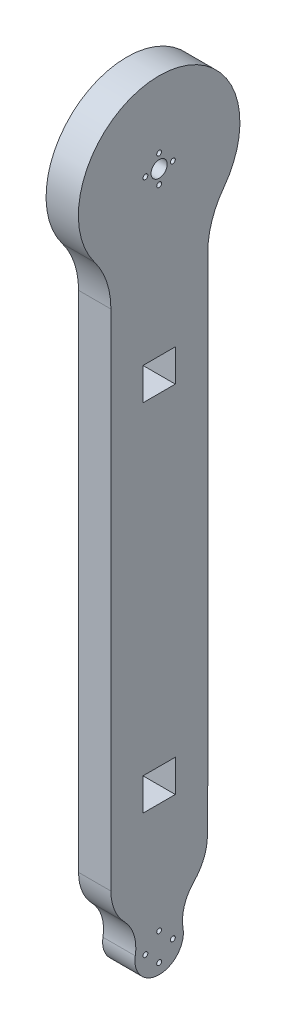
from build123d import *

# Parameters (mm, degrees)
SKETCH1_W           = 10
SKETCH1_H           = 10
BOSS_EXTRUDE1_DEPTH = 10
SKETCH2_R           = 0.75
CUT_EXTRUDE1_DEPTH  = 170.265249142
SKETCH3_R           = 0.75
CUT_EXTRUDE2_DEPTH  = 170.265249142
CUT_EXTRUDE5_START  = -10
CUT_EXTRUDE5_DEPTH  = 10
SKETCH5_R           = 2.5
CUT_EXTRUDE6_DEPTH  = 170.265249142


with BuildPart() as part:
    # Sketch1 → Boss-Extrude1 (new body)
    with BuildSketch(Plane(origin=(0, 0, 0), x_dir=(0, 0, -1), z_dir=(1, 0, 0))):
        with BuildLine():
            Line((0, 109.22405545), (0, -43.10336506))
            ThreePointArc((0, -43.10336506), (0.541577594, -48.278843147), (2.142845875, -53.230087397))
            ThreePointArc((2.142845875, -53.230087397), (-15.125529103, -79.668997921), (-32.212650318, -53.112585274))
            ThreePointArc((-32.212650318, -53.112585274), (-30.559421631, -48.088849966), (-30, -42.82975033))
            Line((-30, -42.82975033), (-30, 109.060958061))
            ThreePointArc((-30, 109.060958061), (-31.291322972, 116.99182394), (-35.031890687, 124.103385075))
            ThreePointArc((-35.031890687, 124.103385075), (-15.112146754, 164.150992221), (4.970722417, 124.184939097))
            ThreePointArc((4.970722417, 124.184939097), (1.275203483, 117.106569656), (0, 109.22405545))
        make_face()
        with Locations((-15.061172266, 83.959086258)):
            Rectangle(SKETCH1_W, SKETCH1_H, mode=Mode.SUBTRACT)
        with Locations((-15.061172266, -26.040913742)):
            Rectangle(SKETCH1_W, SKETCH1_H, mode=Mode.SUBTRACT)
    extrude(amount=BOSS_EXTRUDE1_DEPTH)

    # Sketch2 → Cut-Extrude1 (cut, through all)
    with BuildSketch(Plane(origin=(10, 0, 0), x_dir=(0, 0, -1), z_dir=(1, 0, 0))):
        with Locations((-15.061172266, 143.397777589)):
            Circle(SKETCH2_R)
        with Locations((-19.311172266, 139.147777589)):
            Circle(SKETCH2_R)
        with Locations((-10.811172266, 139.147777589)):
            Circle(SKETCH2_R)
        with Locations((-15.061172266, 134.897777589)):
            Circle(SKETCH2_R)
    extrude(amount=-CUT_EXTRUDE1_DEPTH, mode=Mode.SUBTRACT)

    # Sketch3 → Cut-Extrude2 (cut, through all)
    with BuildSketch(Plane(origin=(10, 0, 0), x_dir=(0, 0, -1), z_dir=(1, 0, 0))):
        with Locations((-19.311172266, -69.352222411)):
            Circle(SKETCH3_R)
        with Locations((-15.061172266, -65.102222411)):
            Circle(SKETCH3_R)
        with Locations((-10.811172266, -69.352222411)):
            Circle(SKETCH3_R)
        with Locations((-15.061172266, -73.602222411)):
            Circle(SKETCH3_R)
    extrude(amount=-CUT_EXTRUDE2_DEPTH, mode=Mode.SUBTRACT)

    # Sketch4 → Cut-Extrude5 (cut)
    with BuildSketch(Plane(origin=(10, 0, 0), x_dir=(0, 0, -1), z_dir=(1, 0, 0)).offset(CUT_EXTRUDE5_START)):
        with BuildLine():
            Line((-30, -42.82975033), (-30, -33.739733883))
            Line((-30, -33.739733883), (-50.712575643, -33.739733883))
            Line((-50.712575643, -33.739733883), (-50.712575643, -86.676053834))
            Line((-50.712575643, -86.676053834), (22.03762198, -86.676053834))
            Line((22.03762198, -86.676053834), (22.03762198, -33.739733883))
            Line((22.03762198, -33.739733883), (0, -33.739733883))
            Line((0, -33.739733883), (0, -43.10336506))
            ThreePointArc((0, -43.10336506), (0.541577594, -48.278843147), (2.142845875, -53.230087397))
            ThreePointArc((2.142845875, -53.230087397), (-15.125529103, -79.668997921), (-32.212650318, -53.112585274))
            ThreePointArc((-32.212650318, -53.112585274), (-30.559421631, -48.088849966), (-30, -42.82975033))
        make_face()
        with BuildLine():
            Line((-30, -46.956071773), (-30, -42.82975033))
            ThreePointArc((-30, -42.82975033), (-30.559421631, -48.088849966), (-32.212650318, -53.112585274))
            ThreePointArc((-32.212650318, -53.112585274), (-15.125529103, -79.668997921), (2.142845875, -53.230087397))
            ThreePointArc((2.142845875, -53.230087397), (0.541577594, -48.278843147), (0, -43.10336506))
            Line((0, -43.10336506), (0, -33.739733883))
            Line((0, -33.739733883), (-0.122344533, -33.739733883))
            Line((-0.122344533, -33.739733883), (-0.122344533, -46.956071773))
            ThreePointArc((-0.122344533, -46.956071773), (-1.211385526, -52.547049066), (-4.319271357, -57.320526105))
            ThreePointArc((-4.319271357, -57.320526105), (-7.279094989, -62.31182931), (-7.666142531, -68.101808395))
            ThreePointArc((-7.666142531, -68.101808395), (-15.061172266, -76.852222411), (-22.456202002, -68.101808395))
            ThreePointArc((-22.456202002, -68.101808395), (-22.843249544, -62.31182931), (-25.803073176, -57.320526105))
            ThreePointArc((-25.803073176, -57.320526105), (-28.910959007, -52.547049066), (-30, -46.956071773))
        make_face()
    extrude(amount=CUT_EXTRUDE5_DEPTH, mode=Mode.SUBTRACT)

    # Sketch5 → Cut-Extrude6 (cut, through all)
    with BuildSketch(Plane(origin=(10, 0, 0), x_dir=(0, 0, -1), z_dir=(1, 0, 0))):
        with Locations((-15.061172266, 139.147777589)):
            Circle(SKETCH5_R)
    extrude(amount=-CUT_EXTRUDE6_DEPTH, mode=Mode.SUBTRACT)


solid = part.part
